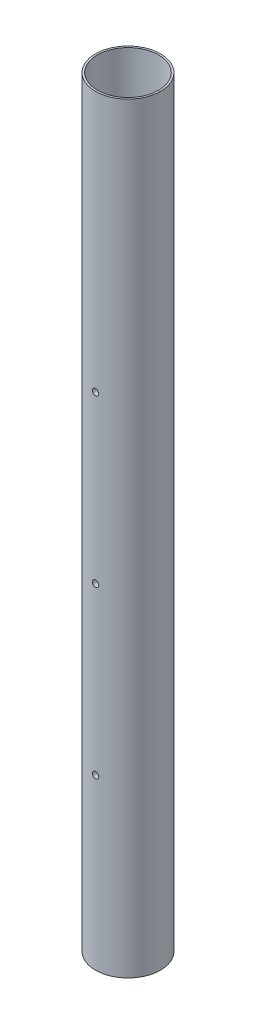
from build123d import *
from build123d.topology import SkipClean

# Parameters (mm, degrees)
SKETCH1_R               = 10.3
BOSS_EXTRUDE1_DEPTH     = 210
BOSS_EXTRUDE3_START     = -2
SKETCH1_4_R             = 10.3
SKETCH1_4_R_2           = 9.7
SKETCH1_4_R_3           = 6.25
BOSS_EXTRUDE3_DEPTH     = 2
BOSS_EXTRUDE2_START     = 210
SKETCH1_3_R             = 10.3
SKETCH1_3_R_2           = 9.7
BOSS_EXTRUDE2_DEPTH     = 29
FILLET1_R               = 2
CUT_EXTRUDE1_REACH      = 242.107
CUT_EXTRUDE1_END_RADIUS = 6.25
SKETCH3_R               = 1
CIRPATTERN1_COUNT       = 2


with BuildPart() as part:
    # Sketch1 → Boss-Extrude1 (new body)
    with BuildSketch(Plane(origin=(0, 0, 0), x_dir=(1, 0, 0), z_dir=(0, 1, 0))):
        with Locations(Location((0, 0, 0), (0, 0, 270))):
            Circle(SKETCH1_R)
        with BuildLine():
            Line((6.16948134, 1), (9.648315915, 1))
            ThreePointArc((9.648315915, 1), (9.7, 0), (9.648315915, -1))
            Line((9.648315915, -1), (6.16948134, -1))
            ThreePointArc((6.16948134, -1), (0, -6.25), (-6.16948134, -1))
            Line((-6.16948134, -1), (-9.648315915, -1))
            ThreePointArc((-9.648315915, -1), (-9.7, 0), (-9.648315915, 1))
            Line((-9.648315915, 1), (-6.16948134, 1))
            ThreePointArc((-6.16948134, 1), (0, 6.25), (6.16948134, 1))
        make_face(mode=Mode.SUBTRACT)
    extrude(amount=BOSS_EXTRUDE1_DEPTH)

    # Sketch1<4> → Boss-Extrude3 (add)
    # profile 1 of 6: a face of its own
    with BuildSketch(Plane(origin=(0, 0, 0), x_dir=(1, 0, 0), z_dir=(0, 1, 0)).offset(BOSS_EXTRUDE3_START)):
        with Locations(Location((0, 0, 0), (0, 0, 270))):
            Circle(SKETCH1_4_R)
        Circle(SKETCH1_4_R_2, mode=Mode.SUBTRACT)
    # profile 2 of 6: a face of its own
    with BuildSketch(Plane(origin=(0, 0, 0), x_dir=(1, 0, 0), z_dir=(0, 1, 0)).offset(BOSS_EXTRUDE3_START)):
        with BuildLine():
            ThreePointArc((9.648315915, 1), (0, 9.7), (-9.648315915, 1))
            Line((-9.648315915, 1), (-6.16948134, 1))
            ThreePointArc((-6.16948134, 1), (0, 6.25), (6.16948134, 1))
            Line((6.16948134, 1), (9.648315915, 1))
        make_face()
    # profile 3 of 6: a face of its own
    with BuildSketch(Plane(origin=(0, 0, 0), x_dir=(1, 0, 0), z_dir=(0, 1, 0)).offset(BOSS_EXTRUDE3_START)):
        with BuildLine():
            ThreePointArc((9.7, 0), (9.687070362, 0.500667366), (9.648315915, 1))
            Line((9.648315915, 1), (6.16948134, 1))
            ThreePointArc((6.16948134, 1), (6.229837814, 0.501618195), (6.25, 0))
            ThreePointArc((6.25, 0), (6.229837814, -0.501618195), (6.16948134, -1))
            Line((6.16948134, -1), (9.648315915, -1))
            ThreePointArc((9.648315915, -1), (9.687070362, -0.500667366), (9.7, 0))
        make_face()
    # profile 4 of 6: a face of its own
    with BuildSketch(Plane(origin=(0, 0, 0), x_dir=(1, 0, 0), z_dir=(0, 1, 0)).offset(BOSS_EXTRUDE3_START)):
        with BuildLine():
            Line((-6.16948134, -1), (-9.648315915, -1))
            ThreePointArc((-9.648315915, -1), (0, -9.7), (9.648315915, -1))
            Line((9.648315915, -1), (6.16948134, -1))
            ThreePointArc((6.16948134, -1), (0, -6.25), (-6.16948134, -1))
        make_face()
    # profile 5 of 6: a face of its own
    with BuildSketch(Plane(origin=(0, 0, 0), x_dir=(1, 0, 0), z_dir=(0, 1, 0)).offset(BOSS_EXTRUDE3_START)):
        Circle(SKETCH1_4_R_3)
    # profile 6 of 6: a face of its own
    with BuildSketch(Plane(origin=(0, 0, 0), x_dir=(1, 0, 0), z_dir=(0, 1, 0)).offset(BOSS_EXTRUDE3_START)):
        with BuildLine():
            Line((-6.16948134, 1), (-9.648315915, 1))
            ThreePointArc((-9.648315915, 1), (-9.7, 0), (-9.648315915, -1))
            Line((-9.648315915, -1), (-6.16948134, -1))
            ThreePointArc((-6.16948134, -1), (-6.25, 0), (-6.16948134, 1))
        make_face()
    extrude(amount=BOSS_EXTRUDE3_DEPTH)

    # Sketch1<3> → Boss-Extrude2 (add)
    with SkipClean():  # the faces are left unmerged after this step: merging them gives an invalid solid
        with BuildSketch(Plane(origin=(0, 0, 0), x_dir=(1, 0, 0), z_dir=(0, 1, 0)).offset(BOSS_EXTRUDE2_START)):
            with Locations(Location((0, 0, 0), (0, 0, 270))):
                Circle(SKETCH1_3_R)
            with Locations(Location((0, 0, 0), (0, 0, 174.082705248))):
                Circle(SKETCH1_3_R_2, mode=Mode.SUBTRACT)
        extrude(amount=BOSS_EXTRUDE2_DEPTH)

    # Fillet1
    fillet1_edges = [part.edges().sort_by_distance(p)[0] for p in [
        (6.16948134, 105, 1),
        (6.16948134, 105, -1),
        (-6.16948134, 105, -1),
        (-6.16948134, 105, 1),
    ]]
    fillet(fillet1_edges, radius=FILLET1_R)

    # Cut-Extrude1: up to this cylinder (the profile starts outside it)
    with SkipClean():  # the faces are left unmerged after this step: merging them gives an invalid solid
        cut_extrude1_end = Plane(origin=(0, 104, 0), z_dir=(0, -1, 0)) * Cylinder(CUT_EXTRUDE1_END_RADIUS, 602.714, mode=Mode.PRIVATE)
        # Sketch3 → Cut-Extrude1 (cut, up to the surface)
        with BuildSketch(Plane.XY.offset(10.3), mode=Mode.PRIVATE) as cut_extrude1_sk1:
            with BuildLine():
                ThreePointArc((1, 104), (0.707106781, 104.707106781), (0, 105))
                Line((0, 105), (0, 103))
                ThreePointArc((0, 103), (0.707106781, 103.292893219), (1, 104))
            make_face()
        cut_extrude1_tool1 = extrude(cut_extrude1_sk1.sketch, amount=-CUT_EXTRUDE1_REACH, mode=Mode.PRIVATE) - cut_extrude1_end
        # Sketch3 → Cut-Extrude1 (cut, up to the surface)
        with BuildSketch(Plane.XY.offset(10.3), mode=Mode.PRIVATE) as cut_extrude1_sk2:
            with BuildLine():
                Line((0, 103), (0, 105))
                ThreePointArc((0, 105), (-1, 104), (0, 103))
            make_face()
        cut_extrude1_tool2 = extrude(cut_extrude1_sk2.sketch, amount=-CUT_EXTRUDE1_REACH, mode=Mode.PRIVATE) - cut_extrude1_end
        # Sketch3 → Cut-Extrude1 (cut, up to the surface)
        with BuildSketch(Plane.XY.offset(10.3), mode=Mode.PRIVATE) as cut_extrude1_sk3:
            with BuildLine():
                ThreePointArc((1, 104), (0.707106781, 104.707106781), (0, 105))
                Line((0, 105), (0, 103))
                ThreePointArc((0, 103), (0.707106781, 103.292893219), (1, 104))
            make_face()
        cut_extrude1_tool3 = extrude(cut_extrude1_sk3.sketch, amount=-CUT_EXTRUDE1_REACH, mode=Mode.PRIVATE) - cut_extrude1_end
        # Sketch3 → Cut-Extrude1 (cut, up to the surface)
        with BuildSketch(Plane.XY.offset(10.3), mode=Mode.PRIVATE) as cut_extrude1_sk4:
            with BuildLine():
                Line((0, 103), (0, 105))
                ThreePointArc((0, 105), (-1, 104), (0, 103))
            make_face()
        cut_extrude1_tool4 = extrude(cut_extrude1_sk4.sketch, amount=-CUT_EXTRUDE1_REACH, mode=Mode.PRIVATE) - cut_extrude1_end
        # Sketch3 → Cut-Extrude1 (cut, up to the surface)
        with BuildSketch(Plane.XY.offset(10.3), mode=Mode.PRIVATE) as cut_extrude1_sk5:
            with Locations((0, 156.5)):
                Circle(SKETCH3_R)
        cut_extrude1_tool5 = extrude(cut_extrude1_sk5.sketch, amount=-CUT_EXTRUDE1_REACH, mode=Mode.PRIVATE) - cut_extrude1_end
        # Sketch3 → Cut-Extrude1 (cut, up to the surface)
        with BuildSketch(Plane.XY.offset(10.3), mode=Mode.PRIVATE) as cut_extrude1_sk6:
            with Locations((0, 51.5)):
                Circle(SKETCH3_R)
        cut_extrude1_tool6 = extrude(cut_extrude1_sk6.sketch, amount=-CUT_EXTRUDE1_REACH, mode=Mode.PRIVATE) - cut_extrude1_end
        cut_extrude1 = cut_extrude1_tool1.solids().sort_by_distance((0.424413, 104, 10.3))[0] + cut_extrude1_tool2.solids().sort_by_distance((-0.424413, 104, 10.3))[0] + cut_extrude1_tool3.solids().sort_by_distance((0.424413, 104, 10.3))[0] + cut_extrude1_tool4.solids().sort_by_distance((-0.424413, 104, 10.3))[0] + cut_extrude1_tool5.solids().sort_by_distance((0, 156.5, 10.3))[0] + cut_extrude1_tool6.solids().sort_by_distance((0, 51.5, 10.3))[0]
        add(cut_extrude1, mode=Mode.SUBTRACT)

    # CirPattern1: Cut-Extrude1 ×2 about axis
    with SkipClean():  # the faces are left unmerged after this step: merging them gives an invalid solid
        cirpattern1_axis = Axis((0, 210, 0), (0, -1, 0))
        for i in range(1, CIRPATTERN1_COUNT):
            add(cut_extrude1.rotate(cirpattern1_axis, i * 360 / CIRPATTERN1_COUNT), mode=Mode.SUBTRACT)


solid = part.part
